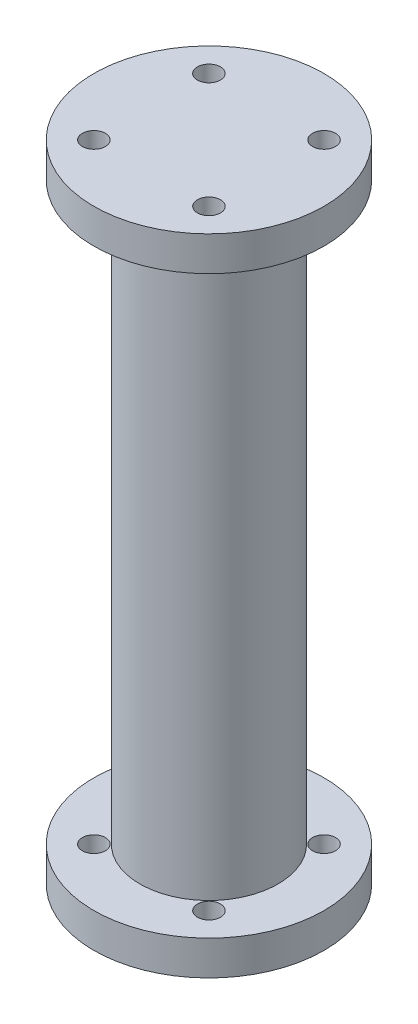
from build123d import *

# Parameters (mm, degrees)
SKETCH_1_W          = 6
SKETCH_1_H          = 50
SKETCH_2_W          = 10
SKETCH_2_H          = 3
SKETCH_3_R          = 1
CUT_EXTRUDE_1_DEPTH = 5000


with BuildPart() as part:
    # 草图1 → 旋转1 (revolve)
    with BuildSketch(Plane.XY, mode=Mode.PRIVATE) as revolve_1_sk:
        with Locations((3, 0)):
            Rectangle(SKETCH_1_W, SKETCH_1_H)
    revolve(revolve_1_sk.sketch.rotate(Axis((0, 25, 0), (0, -1, 0)), 180), axis=Axis((0, 25, 0), (0, -1, 0)))

    # 草图2 → 旋转2 (revolve)
    with BuildSketch(Plane.XY):
        with Locations((5, 26.5)):
            Rectangle(SKETCH_2_W, SKETCH_2_H)
        with Locations((5, -26.5)):
            Rectangle(SKETCH_2_W, SKETCH_2_H)
    revolve(axis=Axis((0, 25, 0), (0, 1, 0)))

    # 草图3 → 切除-拉伸1 (cut)
    with BuildSketch(Plane(origin=(0, 28, 0), x_dir=(1, 0, 0), z_dir=(0, 1, 0))):
        with Locations(Location((-5, 5, 0), (0, 0, 180))):
            Circle(SKETCH_3_R)
        with Locations(Location((5, 5, 0), (0, 0, 180))):
            Circle(SKETCH_3_R)
        with Locations(Location((-5, -5, 0), (0, 0, 180))):
            Circle(SKETCH_3_R)
        with Locations(Location((5, -5, 0), (0, 0, 180))):
            Circle(SKETCH_3_R)
    extrude(amount=-CUT_EXTRUDE_1_DEPTH, mode=Mode.SUBTRACT)


solid = part.part
